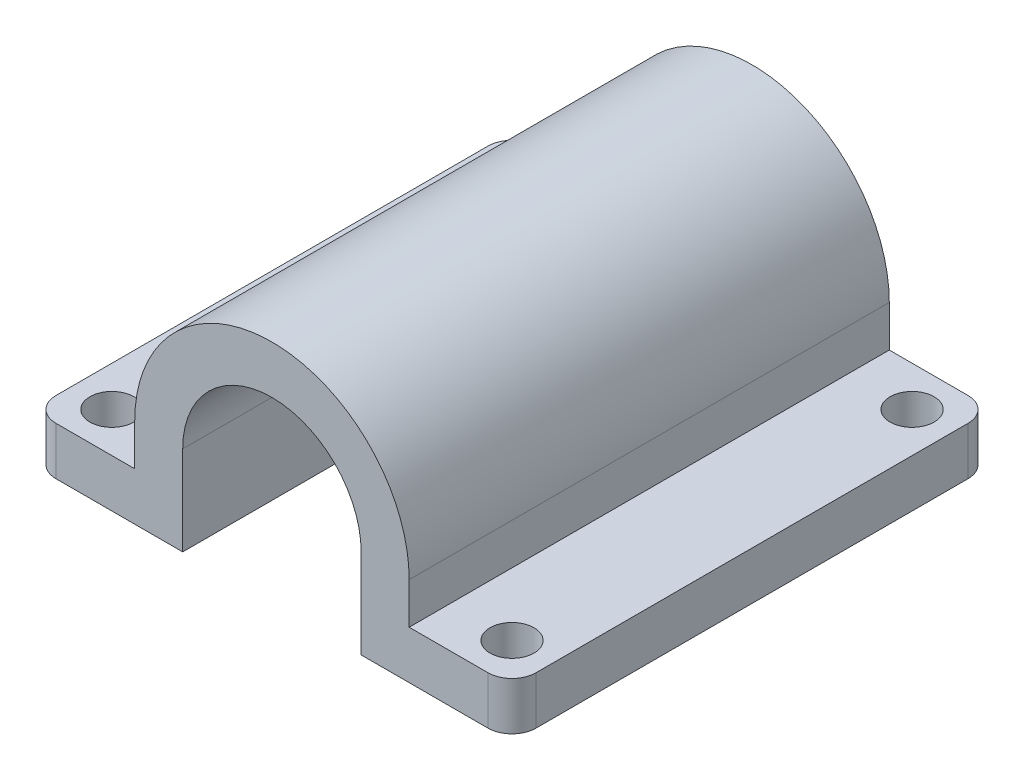
from build123d import *

# Parameters (mm, degrees)
BOSS_EXTRUDE1_DEPTH = 60
SKETCH2_R           = 2.75
CUT_EXTRUDE1_DEPTH  = 6
FILLET1_R           = 3


with BuildPart() as part:
    # Sketch1 → Boss-Extrude1 (new body)
    with BuildSketch(Plane.XY):
        with BuildLine():
            Line((-11.15, 0), (-11.15, -11.15))
            Line((-11.15, -11.15), (-30, -11.15))
            Line((-30, -11.15), (-30, -5.15))
            Line((-30, -5.15), (-17.15, -5.15))
            Line((-17.15, -5.15), (-17.15, 0))
            ThreePointArc((-17.15, 0), (0, 17.15), (17.15, 0))
            Line((17.15, 0), (17.15, -5.15))
            Line((17.15, -5.15), (30, -5.15))
            Line((30, -5.15), (30, -11.15))
            Line((30, -11.15), (11.15, -11.15))
            Line((11.15, -11.15), (11.15, 0))
            ThreePointArc((11.15, 0), (0, 11.15), (-11.15, 0))
        make_face()
    extrude(amount=BOSS_EXTRUDE1_DEPTH)

    # Sketch2 → Cut-Extrude1 (cut)
    with BuildSketch(Plane(origin=(0, -5.15, 0), x_dir=(1, 0, 0), z_dir=(0, 1, 0))):
        with Locations(Location((-25, -5, 0), (0, 0, 270))):
            Circle(SKETCH2_R)
        with Locations(Location((-25, -55, 0), (0, 0, 90))):
            Circle(SKETCH2_R)
        with Locations(Location((25, -55, 0), (0, 0, 270))):
            Circle(SKETCH2_R)
        with Locations(Location((25, -5, 0), (0, 0, 90))):
            Circle(SKETCH2_R)
    extrude(amount=-CUT_EXTRUDE1_DEPTH, mode=Mode.SUBTRACT)

    # Fillet1
    fillet1_edges = [part.edges().sort_by_distance(p)[0] for p in [
        (-30, -8.15, 0),
        (30, -8.15, 0),
        (30, -8.15, 60),
        (-30, -8.15, 60),
    ]]
    fillet(fillet1_edges, radius=FILLET1_R)


solid = part.part
